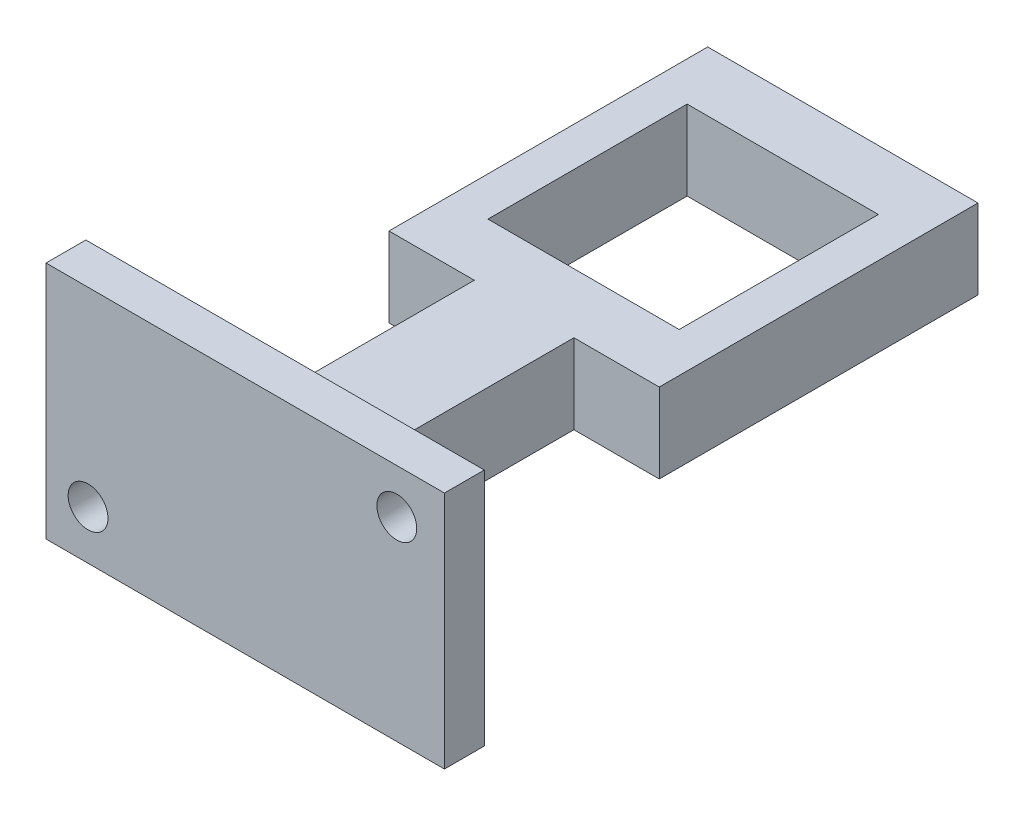
from build123d import *

# Parameters (mm, degrees)
SKETCH1_W                = 50
SKETCH1_H                = 30
BOSS_EXTRUDE1_DEPTH      = 5
BOSS_EXTRUDE2_DEPTH      = 5
BOSS_EXTRUDE2_DEPTH_BACK = 5
SKETCH3_W                = 24
SKETCH3_H                = 25
CUT_EXTRUDE1_DEPTH       = 10
SKETCH4_R                = 2.5
CUT_EXTRUDE2_DEPTH       = 10
SKETCH5_R                = 2.5
CUT_EXTRUDE3_DEPTH       = 10


with BuildPart() as part:
    # Sketch1 → Boss-Extrude1 (new body)
    with BuildSketch(Plane.XY):
        Rectangle(SKETCH1_W, SKETCH1_H)
    extrude(amount=BOSS_EXTRUDE1_DEPTH)

    # Sketch2 → Boss-Extrude2 (add, two sides: drawn at the far end of the back side and taken through both)
    with BuildSketch(Plane(origin=(0, 0, 0), x_dir=(1, 0, 0), z_dir=(0, 1, 0)).offset(-BOSS_EXTRUDE2_DEPTH_BACK)):
        Polygon((-6.250199949, 30), (-6.250199949, 0), (6.250199949, 0), (6.250199949, 30), (16.958872349, 30), (16.958872349, 70), (-16.958872349, 70), (-16.958872349, 30), align=None)
    extrude(amount=BOSS_EXTRUDE2_DEPTH + BOSS_EXTRUDE2_DEPTH_BACK)

    # Sketch3 → Cut-Extrude1 (cut)
    with BuildSketch(Plane(origin=(0, 5, 0), x_dir=(1, 0, 0), z_dir=(0, 1, 0))):
        with Locations((-0.041127651, 50)):
            Rectangle(SKETCH3_W, SKETCH3_H)
    extrude(amount=-CUT_EXTRUDE1_DEPTH, mode=Mode.SUBTRACT)

    # Sketch4 → Cut-Extrude2 (cut)
    with BuildSketch(Plane(origin=(0, 0, 0), x_dir=(-1, 0, 0), z_dir=(0, 0, -1))):
        with Locations((-19.020005018, 9.402240441)):
            Circle(SKETCH4_R)
    extrude(amount=-CUT_EXTRUDE2_DEPTH, mode=Mode.SUBTRACT)

    # Sketch5 → Cut-Extrude3 (cut)
    with BuildSketch(Plane(origin=(0, 0, 0), x_dir=(-1, 0, 0), z_dir=(0, 0, -1))):
        with Locations((19.72045846, -8.8634301)):
            Circle(SKETCH5_R)
    extrude(amount=-CUT_EXTRUDE3_DEPTH, mode=Mode.SUBTRACT)


solid = part.part
